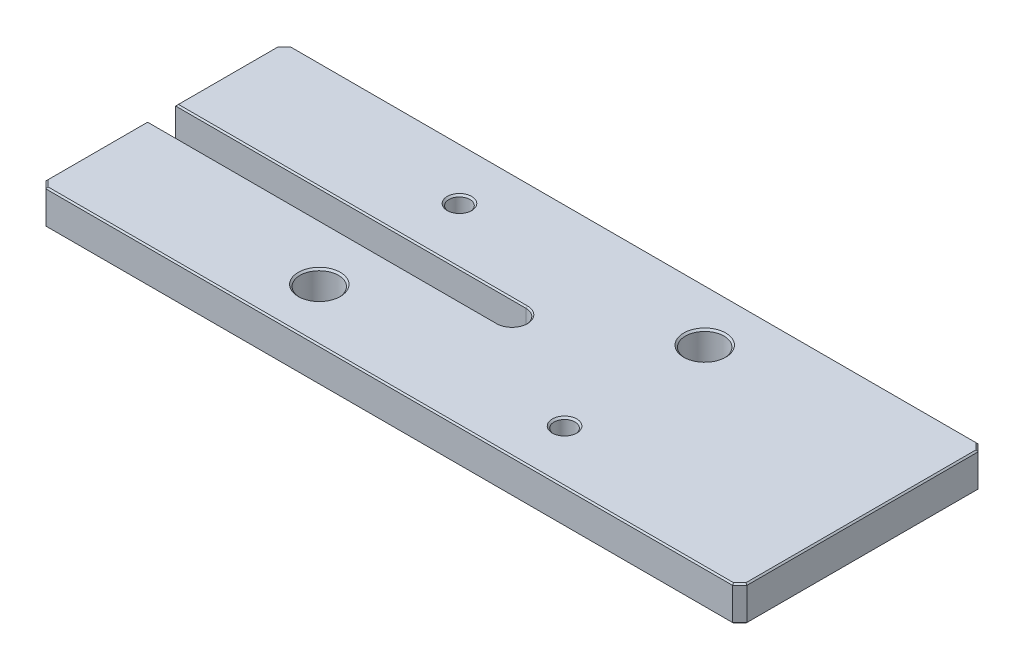
from build123d import *

# Parameters (mm, degrees)
BOSS_EXTRUDE1_DEPTH            = 5
F_3_0MM_DOWEL_HOLE1_AT_2_COUNT = 2
F_3_0MM_DOWEL_HOLE1_AT_2_PITCH = 40.311288741
M5_CLEARANCE_HOLE1_AT_2_COUNT  = 2
M5_CLEARANCE_HOLE1_AT_2_PITCH  = 40.311288741
CHAMFER1_SIZE                  = 1
CHAMFER2_SIZE                  = 0.2


with BuildPart() as part:
    # Sketch2 → Boss-Extrude1 (new body)
    with BuildSketch(Plane(origin=(0, 0, 0), x_dir=(1, 0, 0), z_dir=(0, 1, 0))):
        with BuildLine():
            Line((-50, 2), (0, 2))
            ThreePointArc((0, 2), (2, 0), (0, -2))
            Line((0, -2), (-50, -2))
            Line((-50, -2), (-50, -17.5))
            Line((-50, -17.5), (50, -17.5))
            Line((50, -17.5), (50, 17.5))
            Line((50, 17.5), (-50, 17.5))
            Line((-50, 17.5), (-50, 2))
        make_face()
    extrude(amount=BOSS_EXTRUDE1_DEPTH)

    # Sketch4 → Ø3.0mm Dowel Hole1 (revolve, cut)
    with BuildSketch(Plane(origin=(-17.5, 5, -10), x_dir=(0, 0, 1), z_dir=(1, 0, 0))):
        Polygon((0, 0), (0, 5), (1.75, 5), (1.5, 4.75), (1.5, 0.25), (1.75, 0), align=None)
    f_3_0mm_dowel_hole1 = revolve(axis=Axis((-17.5, 11.35, -10), (0, -1, 0)), mode=Mode.SUBTRACT)

    # Ø3.0mm Dowel Hole1 at 2: Ø3.0mm Dowel Hole1 ×2
    with Locations(*[Vector(0.8682431421244593, 0, 0.4961389383568337) * (i * F_3_0MM_DOWEL_HOLE1_AT_2_PITCH) for i in range(1, F_3_0MM_DOWEL_HOLE1_AT_2_COUNT)]):
        add(f_3_0mm_dowel_hole1, mode=Mode.SUBTRACT)

    # Sketch6 → M5 Clearance Hole1 (revolve, cut)
    with BuildSketch(Plane(origin=(-17.5, 5, 10), x_dir=(0, 0, 1), z_dir=(1, 0, 0))):
        Polygon((0, 0), (0, 5), (3, 5), (2.75, 4.75), (2.75, 0.25), (3, 0), align=None)
    m5_clearance_hole1 = revolve(axis=Axis((-17.5, 11.35, 10), (0, -1, 0)), mode=Mode.SUBTRACT)

    # M5 Clearance Hole1 at 2: M5 Clearance Hole1 ×2
    with Locations(*[Vector(0.8682431421244592, 0, -0.4961389383568339) * (i * M5_CLEARANCE_HOLE1_AT_2_PITCH) for i in range(1, M5_CLEARANCE_HOLE1_AT_2_COUNT)]):
        add(m5_clearance_hole1, mode=Mode.SUBTRACT)

    # Chamfer1
    chamfer1_edges = [part.edges().sort_by_distance(p)[0] for p in [
        (50, 2.5, 17.5),
        (-50, 2.5, 17.5),
        (-50, 2.5, -17.5),
        (50, 2.5, -17.5),
    ]]
    chamfer(chamfer1_edges, length=CHAMFER1_SIZE)

    # Chamfer2
    chamfer2_edges = [part.edges().sort_by_distance(p)[0] for p in [
        (-25, 0, -2),
        (-25, 5, -2),
        (2, 5, 0),
        (-25, 5, 2),
        (-50, 5, 9.25),
        (0, 0, -17.5),
        (0, 5, -17.5),
        (50, 0, 0),
        (0, 0, 17.5),
        (-50, 0, -9.25),
        (-49.5, 0, -17),
        (-49.5, 0, 17),
        (49.5, 0, 17),
        (49.5, 0, -17),
        (50, 5, 0),
        (-50, 5, -9.25),
        (0, 5, 17.5),
        (-49.5, 5, -17),
        (-49.5, 5, 17),
        (49.5, 5, 17),
        (49.5, 5, -17),
        (-50, 0, 9.25),
        (-25, 0, 2),
        (2, 0, 0),
    ]]
    chamfer(chamfer2_edges, length=CHAMFER2_SIZE)


solid = part.part
